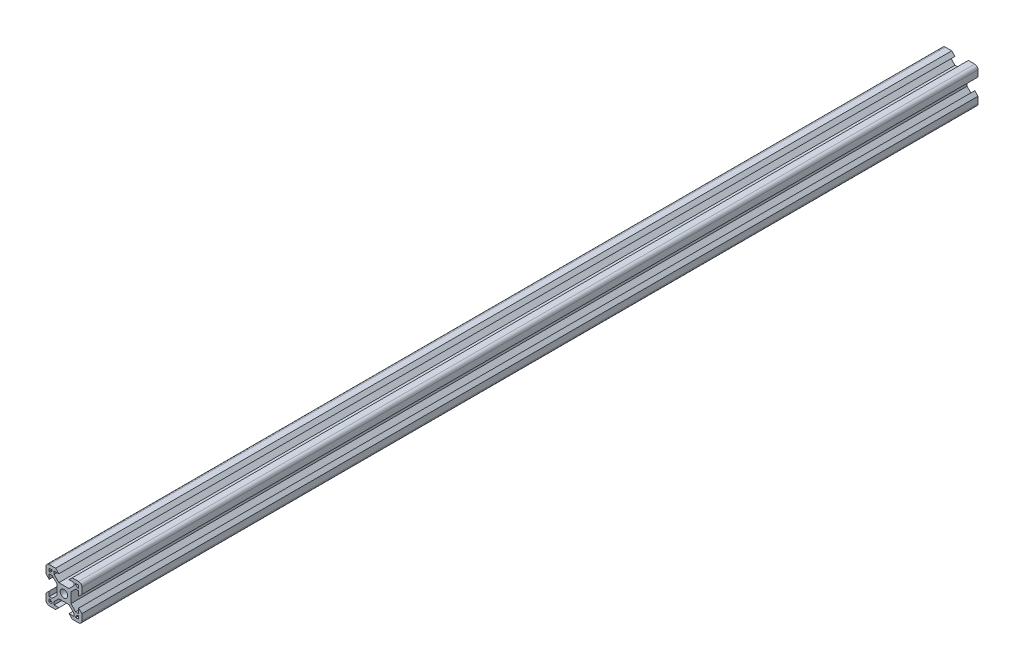
from build123d import *

# Parameters (mm, degrees)
ESQUISSE1_R        = 2.1
BOSS_EXTRU_2_DEPTH = 250


with BuildPart() as part:
    # Esquisse1 → Boss.-Extru.2 (new, symmetric)
    with BuildSketch(Plane.XY):
        with BuildLine():
            Line((-3.900660172, 0), (-3.900660172, -2.84))
            Line((-3.900660172, -2.84), (-6.56, -5.499339828))
            Line((-6.56, -5.499339828), (-8.2, -5.499339828))
            Line((-8.2, -5.499339828), (-8.2, -2.84))
            Line((-8.2, -2.84), (-10, -4.64))
            Line((-10, -4.64), (-10, -8.2))
            ThreePointArc((-10, -8.2), (-9.472792206, -9.472792206), (-8.2, -10))
            Line((-8.2, -10), (-4.64, -10))
            Line((-4.64, -10), (-2.84, -8.2))
            Line((-2.84, -8.2), (-5.499339828, -8.2))
            Line((-5.499339828, -8.2), (-5.499339828, -6.56))
            Line((-5.499339828, -6.56), (-2.84, -3.900660172))
            Line((-2.84, -3.900660172), (0, -3.900660172))
            Line((0, -3.900660172), (2.84, -3.900660172))
            Line((2.84, -3.900660172), (5.499339828, -6.56))
            Line((5.499339828, -6.56), (5.499339828, -8.2))
            Line((5.499339828, -8.2), (2.84, -8.2))
            Line((2.84, -8.2), (4.64, -10))
            Line((4.64, -10), (8.2, -10))
            ThreePointArc((8.2, -10), (9.472792206, -9.472792206), (10, -8.2))
            Line((10, -8.2), (10, -4.64))
            Line((10, -4.64), (8.2, -2.84))
            Line((8.2, -2.84), (8.2, -5.499339828))
            Line((8.2, -5.499339828), (6.56, -5.499339828))
            Line((6.56, -5.499339828), (3.900660172, -2.84))
            Line((3.900660172, -2.84), (3.900660172, 0))
            Line((3.900660172, 0), (3.900660172, 2.84))
            Line((3.900660172, 2.84), (6.56, 5.499339828))
            Line((6.56, 5.499339828), (8.2, 5.499339828))
            Line((8.2, 5.499339828), (8.2, 2.84))
            Line((8.2, 2.84), (10, 4.64))
            Line((10, 4.64), (10, 8.2))
            ThreePointArc((10, 8.2), (9.472792206, 9.472792206), (8.2, 10))
            Line((8.2, 10), (4.64, 10))
            Line((4.64, 10), (2.84, 8.2))
            Line((2.84, 8.2), (5.499339828, 8.2))
            Line((5.499339828, 8.2), (5.499339828, 6.56))
            Line((5.499339828, 6.56), (2.84, 3.900660172))
            Line((2.84, 3.900660172), (0, 3.900660172))
            Line((0, 3.900660172), (-2.84, 3.900660172))
            Line((-2.84, 3.900660172), (-5.499339828, 6.56))
            Line((-5.499339828, 6.56), (-5.499339828, 8.2))
            Line((-5.499339828, 8.2), (-2.84, 8.2))
            Line((-2.84, 8.2), (-4.64, 10))
            Line((-4.64, 10), (-8.2, 10))
            ThreePointArc((-8.2, 10), (-9.472792206, 9.472792206), (-10, 8.2))
            Line((-10, 8.2), (-10, 4.64))
            Line((-10, 4.64), (-8.2, 2.84))
            Line((-8.2, 2.84), (-8.2, 5.499339828))
            Line((-8.2, 5.499339828), (-6.56, 5.499339828))
            Line((-6.56, 5.499339828), (-3.900660172, 2.84))
            Line((-3.900660172, 2.84), (-3.900660172, 0))
        make_face()
        Circle(ESQUISSE1_R, mode=Mode.SUBTRACT)
        Polygon((-8.2, -8.2), (-8.2, -6.569339828), (-7.63, -6.569339828), (-6.569339828, -7.63), (-6.569339828, -8.2), align=None, mode=Mode.SUBTRACT)
        Polygon((-8.2, 6.569339828), (-8.2, 8.2), (-6.569339828, 8.2), (-6.569339828, 7.63), (-7.63, 6.569339828), align=None, mode=Mode.SUBTRACT)
        Polygon((6.569339828, 8.2), (8.2, 8.2), (8.2, 6.569339828), (7.63, 6.569339828), (6.569339828, 7.63), align=None, mode=Mode.SUBTRACT)
        Polygon((8.2, -6.569339828), (8.2, -8.2), (6.569339828, -8.2), (6.569339828, -7.63), (7.63, -6.569339828), align=None, mode=Mode.SUBTRACT)
    extrude(amount=BOSS_EXTRU_2_DEPTH, both=True)


solid = part.part
